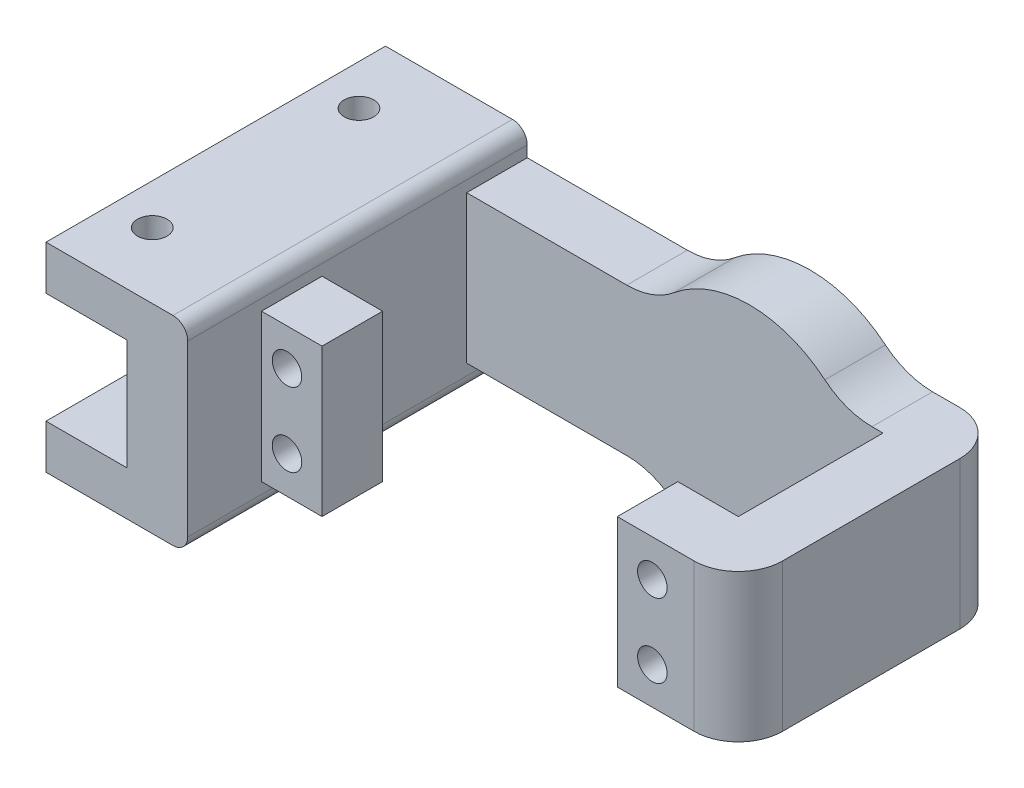
from build123d import *

# Parameters (mm, degrees)
SCHIZZO1_W                     = 64.6
SCHIZZO1_H                     = 20
ESTRUSIONE_ESTRUSIONE1_DEPTH   = 8.2
SCHIZZO2_W                     = 8.2
SCHIZZO2_H                     = 20
ESTRUSIONE_ESTRUSIONE2_DEPTH   = 27.8
SCHIZZO3_W                     = 8.2
SCHIZZO3_H                     = 20
ESTRUSIONE_ESTRUSIONE3_DEPTH   = 27.8
SCHIZZO4_W                     = 8.2
SCHIZZO4_H                     = 20
ESTRUSIONE_ESTRUSIONE4_DEPTH   = 8.2
SCHIZZO5_W                     = 36
SCHIZZO5_H                     = 20
ESTRUSIONE_ESTRUSIONE5_DEPTH   = 8.2
SCHIZZO6_W                     = 48.2
SCHIZZO6_H                     = 19.6
TAGLIO_ESTRUSIONE1_DEPTH       = 77.610443152
F_4_0_4_DIAMETER_HOLE2_D       = 4
F_4_0_4_DIAMETER_HOLE2_DEPTH   = 8.2
SCHIZZO11_R                    = 16
ESTRUSIONE_ESTRUSIONE6_DEPTH   = 8.2
RACCORDO1_R                    = 10
F_22_0_22_DIAMETER_HOLE1_D     = 22
F_22_0_22_DIAMETER_HOLE1_DEPTH = 10
F_22_0_22_DIAMETER_HOLE1_TIP   = 6.609466809
RACCORDO3_R                    = 6
SCHIZZO15_W                    = 8.2
SCHIZZO15_H                    = 36
ESTRUSIONE_ESTRUSIONE7_DEPTH   = 3.5
SCHIZZO16_W                    = 8.2
SCHIZZO16_H                    = 36
ESTRUSIONE_ESTRUSIONE8_DEPTH   = 3.5
SCHIZZO17_W                    = 36
SCHIZZO17_H                    = 6
ESTRUSIONE_ESTRUSIONE9_DEPTH   = 11
RACCORDO6_R                    = 2
SCHIZZO23_R                    = 11
ESTRUSIONE_ESTRUSIONE10_DEPTH  = 2.2
ESTRUSIONE_ESTRUSIONE11_DEPTH  = 10
F_4_0_4_DIAMETER_HOLE1_D       = 4


with BuildPart() as part:
    # Schizzo1 → Estrusione-Estrusione1 (new body)
    with BuildSketch(Plane.XY):
        with Locations((32.3, 10)):
            Rectangle(SCHIZZO1_W, SCHIZZO1_H)
    extrude(amount=ESTRUSIONE_ESTRUSIONE1_DEPTH)

    # Schizzo2 → Estrusione-Estrusione2 (add)
    with BuildSketch(Plane.XY.offset(8.2)):
        with Locations((4.1, 10)):
            Rectangle(SCHIZZO2_W, SCHIZZO2_H)
    extrude(amount=ESTRUSIONE_ESTRUSIONE2_DEPTH)

    # Schizzo3 → Estrusione-Estrusione3 (add)
    with BuildSketch(Plane.XY.offset(8.2)):
        with Locations((60.5, 10)):
            Rectangle(SCHIZZO3_W, SCHIZZO3_H)
    extrude(amount=ESTRUSIONE_ESTRUSIONE3_DEPTH)

    # Schizzo4 → Estrusione-Estrusione4 (add)
    with BuildSketch(Plane.ZY.offset(-56.4)):
        with Locations((31.9, 10)):
            Rectangle(SCHIZZO4_W, SCHIZZO4_H)
    extrude(amount=ESTRUSIONE_ESTRUSIONE4_DEPTH)

    # Schizzo5 → Estrusione-Estrusione5 (add)
    with BuildSketch(Plane.ZY):
        with Locations((18, 10)):
            Rectangle(SCHIZZO5_W, SCHIZZO5_H)
    extrude(amount=ESTRUSIONE_ESTRUSIONE5_DEPTH)

    # Schizzo6 → Taglio-Estrusione1 (cut, through all)
    with BuildSketch(Plane.XZ):
        with Locations((24.1, 18)):
            Rectangle(SCHIZZO6_W, SCHIZZO6_H)
    extrude(amount=-TAGLIO_ESTRUSIONE1_DEPTH, mode=Mode.SUBTRACT)

    # Ø4.0 (4) Diameter Hole2
    with Locations(Plane.XY.offset(36)):
        with Locations((52.95, 5), (3.45, 5), (3.45, 15), (52.95, 15)):
            Hole(F_4_0_4_DIAMETER_HOLE2_D / 2, depth=F_4_0_4_DIAMETER_HOLE2_DEPTH)

    # Schizzo11 → Estrusione-Estrusione6 (add)
    with BuildSketch(Plane(origin=(0, 0, 0), x_dir=(-1, 0, 0), z_dir=(0, 0, -1))):
        with Locations((-38.3, 10)):
            Circle(SCHIZZO11_R)
    extrude(amount=-ESTRUSIONE_ESTRUSIONE6_DEPTH)

    # Raccordo1
    raccordo1_edges = [part.edges().sort_by_distance(p)[0] for p in [
        (50.789995997, 0, 4.1),
        (50.789995997, 20, 4.1),
        (25.810004003, 0, 4.1),
        (25.810004003, 20, 4.1),
    ]]
    fillet(raccordo1_edges, radius=RACCORDO1_R)

    # Ø22.0 (22) Diameter Hole1
    with Locations(Plane(origin=(0, 0, 0), x_dir=(-1, 0, 0), z_dir=(0, 0, -1))):
        with Locations((-38.3, 10)):
            Hole(F_22_0_22_DIAMETER_HOLE1_D / 2, depth=F_22_0_22_DIAMETER_HOLE1_DEPTH)
            with Locations((0, 0, -(F_22_0_22_DIAMETER_HOLE1_DEPTH + F_22_0_22_DIAMETER_HOLE1_TIP / 2))):  # 118° drill point
                Cone(0, F_22_0_22_DIAMETER_HOLE1_D / 2, F_22_0_22_DIAMETER_HOLE1_TIP, mode=Mode.SUBTRACT)

    # Raccordo3
    raccordo3_edges = [part.edges().sort_by_distance(p)[0] for p in [
        (64.6, 10, 36),
        (64.6, 10, 0),
    ]]
    fillet(raccordo3_edges, radius=RACCORDO3_R)

    # Schizzo15 → Estrusione-Estrusione7 (add)
    with BuildSketch(Plane.XZ):
        with Locations((-4.1, 18)):
            Rectangle(SCHIZZO15_W, SCHIZZO15_H)
    extrude(amount=ESTRUSIONE_ESTRUSIONE7_DEPTH)

    # Schizzo16 → Estrusione-Estrusione8 (add)
    with BuildSketch(Plane(origin=(0, 20, 0), x_dir=(1, 0, 0), z_dir=(0, 1, 0))):
        with Locations((-4.1, -18)):
            Rectangle(SCHIZZO16_W, SCHIZZO16_H)
    extrude(amount=ESTRUSIONE_ESTRUSIONE8_DEPTH)

    # Schizzo17 → Estrusione-Estrusione9 (add)
    with BuildSketch(Plane.ZY.offset(8.2)):
        with Locations((18, 20.5)):
            Rectangle(SCHIZZO17_W, SCHIZZO17_H)
        with Locations((18, -0.5)):
            Rectangle(SCHIZZO17_W, SCHIZZO17_H)
    extrude(amount=ESTRUSIONE_ESTRUSIONE9_DEPTH)

    # Raccordo6
    raccordo6_edges = [part.edges().sort_by_distance(p)[0] for p in [
        (0, -3.5, 18),
        (0, 23.5, 18),
    ]]
    fillet(raccordo6_edges, radius=RACCORDO6_R)

    # Schizzo23 → Estrusione-Estrusione10 (add)
    with BuildSketch(Plane.XY.offset(8.2)):
        with Locations(Location((38.3, 10, 0), (0, 0, 180))):
            Circle(SCHIZZO23_R)
    extrude(amount=-ESTRUSIONE_ESTRUSIONE10_DEPTH)

    # Schizzo24 → Estrusione-Estrusione11 (add)
    with BuildSketch(Plane.XY.offset(36)):
        with BuildLine():
            Line((-2, 23.5), (-19.2, 23.5))
            Line((-19.2, 23.5), (-19.2, 17.5))
            Line((-19.2, 17.5), (-8.2, 17.5))
            Line((-8.2, 17.5), (-8.2, 2.5))
            Line((-8.2, 2.5), (-19.2, 2.5))
            Line((-19.2, 2.5), (-19.2, -3.5))
            Line((-19.2, -3.5), (-2, -3.5))
            ThreePointArc((-2, -3.5), (-0.585786438, -2.914213562), (0, -1.5))
            Line((0, -1.5), (0, 21.5))
            ThreePointArc((0, 21.5), (-0.585786438, 22.914213562), (-2, 23.5))
        make_face()
    extrude(amount=ESTRUSIONE_ESTRUSIONE11_DEPTH)

    # Ø4.0 (4) Diameter Hole1 (through all)
    with Locations(Plane(origin=(0, -3.5, 0), x_dir=(-1, 0, 0), z_dir=(0, -1, 0))):
        with Locations((13.7, -37.1), (13.7, -9.1)):
            Hole(F_4_0_4_DIAMETER_HOLE1_D / 2)


solid = part.part
